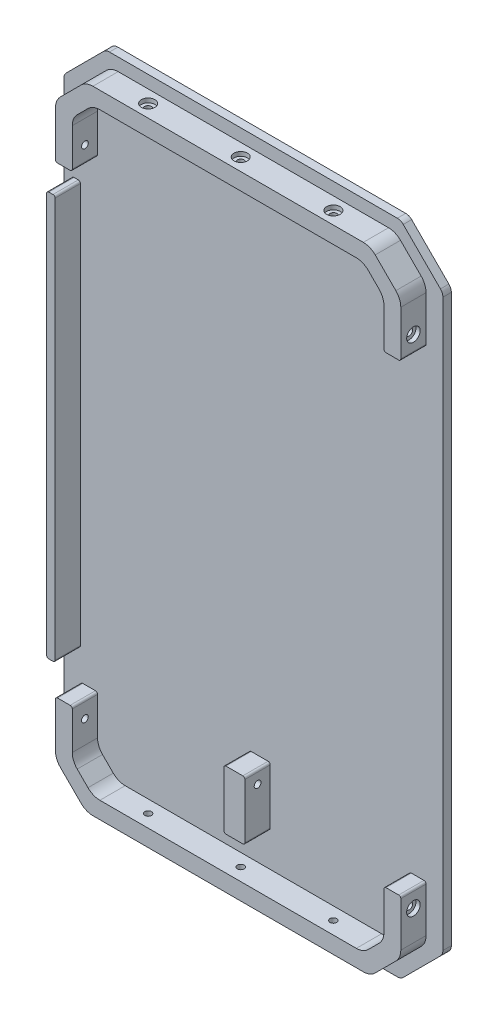
from build123d import *

# Parameters (mm, degrees)
SKETCH_1_W                = 90
SKETCH_1_H                = 156
EXTRUDE_1_DEPTH           = 2
CHAMFER_1_SIZE            = 10
FILLET_648_R              = 2
EXTRUDE_2_DEPTH           = 6
SHELL_3_T                 = -4
SHELL_3_THICKNESS_2_DEPTH = 2
SKETCH_17_W               = 18.399609766
SKETCH_17_H               = 163.649147631
SKETCH_17_W_2             = 16.459731854
SKETCH_17_H_2             = 168.058563627
CUT_EXTRUDE_14_DEPTH      = 6
SKETCH_8_W                = 109.527726605
SKETCH_8_H                = 110
CUT_EXTRUDE_4177_DEPTH    = 6
EXTRUDE_5_DEPTH           = 6
SKETCH_5_R                = 0.8
CUT_EXTRUDE_5486_DEPTH    = 200
FILLET_5638_R             = 4
SKETCH_4_R                = 0.8
CUT_EXTRUDE_6124_DEPTH    = 100
SKETCH_6_W                = 5
SKETCH_6_H                = 14
EXTRUDE_C_DEPTH           = 6
SKETCH_9_R                = 0.8
CUT_EXTRUDE_C_DEPTH       = 50
SKETCH_23_R               = 1.6
CUT_EXTRUDE_16_DEPTH      = 1
CUT_EXTRUDE_START         = -1
SKETCH_24_R               = 1.6
CUT_EXTRUDE_17_DEPTH      = 1
SKETCH_22_R               = 1.6
CUT_EXTRUDE_15_DEPTH      = 1
SKETCH_13_R               = 1.6
CUT_EXTRUDE_10_DEPTH      = 1
SKETCH_18_W               = 2
SKETCH_18_H               = 96
EXTRUDE_4_DEPTH           = 6
FILLET_1_R                = 4
FILLET_2_R                = 0.5
SKETCH_25_W               = 24.531639896
SKETCH_25_H               = 27.877987264
CUT_EXTRUDE_18_DEPTH      = 10


with BuildPart() as part:
    # 草图1 → 凸台-拉伸1 (new body)
    with BuildSketch(Plane.XY):
        with Locations((-45, 78)):
            Rectangle(SKETCH_1_W, SKETCH_1_H)
    extrude(amount=EXTRUDE_1_DEPTH)

    # 倒角1
    chamfer_1_edges = [part.edges().sort_by_distance(p)[0] for p in [
        (0, 0, 1),
        (-90, 0, 1),
        (-90, 156, 1),
        (0, 156, 1),
    ]]
    chamfer(chamfer_1_edges, length=CHAMFER_1_SIZE)

    # Fillet 648
    fillet_648_edges = [part.edges().sort_by_distance(p)[0] for p in [
        (0, 146, 1),
        (0, 10, 1),
        (-80, 0, 1),
        (-10, 0, 1),
        (-90, 146, 1),
        (-90, 10, 1),
        (-10, 156, 1),
        (-80, 156, 1),
    ]]
    fillet(fillet_648_edges, radius=FILLET_648_R)

    # 草图2 → 凸台-拉伸2 (add)
    with BuildSketch(Plane.XY.offset(2)):
        Polygon((-78.757359313, 153), (-11.242640687, 153), (-3, 144.757359313), (-3, 11.242640687), (-11.242640687, 3), (-78.757359313, 3), (-87, 11.242640687), (-87, 144.757359313), align=None)
    extrude(amount=EXTRUDE_2_DEPTH)

    # 抽壳3
    shell_3_openings = [part.faces().sort_by_distance(p)[0] for p in [
        (-45, 78, 8),
    ]]
    offset(amount=SHELL_3_T, openings=shell_3_openings, kind=Kind.INTERSECTION)

    # 抽壳3 thickness 2 face (on inner face of the shell) → 抽壳3 thickness 2 (cut)
    with BuildSketch(Plane(origin=(-45, 78, 4), x_dir=(-1, 0, 0), z_dir=(0, 0, -1))):
        Polygon((38, -65.100505063), (32.100505063, -71), (-32.100505063, -71), (-38, -65.100505063), (-38, 65.100505063), (-32.100505063, 71), (32.100505063, 71), (38, 65.100505063), align=None)
    extrude(amount=SHELL_3_THICKNESS_2_DEPTH, mode=Mode.SUBTRACT)

    # 草图17 → 切除-拉伸14 (cut)
    with BuildSketch(Plane.XY.offset(8)):
        with Locations((-95.199804883, 77.855305794)):
            Rectangle(SKETCH_17_W, SKETCH_17_H)
        with Locations((4.229865927, 75.650597796)):
            Rectangle(SKETCH_17_W_2, SKETCH_17_H_2)
    extrude(amount=-CUT_EXTRUDE_14_DEPTH, mode=Mode.SUBTRACT)

    # 草图8 → Cut-Extrude 4177 (cut)
    with BuildSketch(Plane.XY.offset(8)):
        with Locations((-46.223461864, 78)):
            Rectangle(SKETCH_8_W, SKETCH_8_H)
    extrude(amount=-CUT_EXTRUDE_4177_DEPTH, mode=Mode.SUBTRACT)

    # 草图21 → 凸台-拉伸5 (add)
    with BuildSketch(Plane.XY.offset(2)):
        Polygon((-82, 142.100505063), (-82, 144.100505063), (-83, 143.100505063), (-83, 133), (-82, 133), align=None)
        Polygon((-8, 142.100505063), (-8, 144.100505063), (-7, 143.100505063), (-7, 133), (-8, 133), align=None)
        Polygon((-82, 13.899494937), (-82, 11.899494937), (-83, 12.899494937), (-83, 23), (-82, 23), align=None)
        Polygon((-8, 13.899494937), (-8, 11.899494937), (-7, 12.899494937), (-7, 23), (-8, 23), align=None)
    extrude(amount=EXTRUDE_5_DEPTH)

    # 草图5 → Cut-Extrude 5486 (cut)
    with BuildSketch(Plane(origin=(0, 3, 0), x_dir=(-1, 0, 0), z_dir=(0, -1, 0))):
        with Locations(Location((67, -5, 0), (0, 0, 90))):
            Circle(SKETCH_5_R)
        with Locations(Location((23, -5, 0), (0, 0, 90))):
            Circle(SKETCH_5_R)
        with Locations(Location((45, -5, 0), (0, 0, 90))):
            Circle(SKETCH_5_R)
    extrude(amount=-CUT_EXTRUDE_5486_DEPTH, mode=Mode.SUBTRACT)

    # Fillet 5638
    fillet_5638_edges = [part.edges().sort_by_distance(p)[0] for p in [
        (-4, 145.757359313, 5),
        (-86, 10.242640687, 5),
        (-86, 145.757359313, 5),
        (-4, 10.242640687, 5),
        (-78.757359313, 153, 5),
        (-78.757359313, 3, 5),
        (-11.242640687, 3, 5),
        (-11.242640687, 153, 5),
    ]]
    fillet(fillet_5638_edges, radius=FILLET_5638_R)

    # 草图4 → Cut-Extrude 6124 (cut)
    with BuildSketch(Plane.ZY.offset(87)):
        with Locations(Location((5, 137, 0), (0, 0, 270))):
            Circle(SKETCH_4_R)
        with Locations(Location((5, 19, 0), (0, 0, 270))):
            Circle(SKETCH_4_R)
    extrude(amount=-CUT_EXTRUDE_6124_DEPTH, mode=Mode.SUBTRACT)

    # 草图6 → C板固定 (add)
    with BuildSketch(Plane.XY.offset(2)):
        with Locations((-48.5, 134)):
            Rectangle(SKETCH_6_W, SKETCH_6_H)
        with Locations((-43.5, 22)):
            Rectangle(SKETCH_6_W, SKETCH_6_H)
    extrude(amount=EXTRUDE_C_DEPTH)

    # 草图9 → C板螺纹 (cut)
    with BuildSketch(Plane(origin=(-41, 0, 0), x_dir=(0, 0, -1), z_dir=(1, 0, 0))):
        with Locations(Location((-5, 26, 0), (0, 0, 90))):
            Circle(SKETCH_9_R)
        with Locations((-5, 130)):
            Circle(SKETCH_9_R)
    extrude(amount=-CUT_EXTRUDE_C_DEPTH, mode=Mode.SUBTRACT)

    # 草图23 → 切除-拉伸16 (cut)
    with BuildSketch(Plane.ZY.offset(86)):
        with Locations(Location((5, 137, 0), (0, 0, 270))):
            Circle(SKETCH_23_R)
        with Locations(Location((5, 19, 0), (0, 0, 270))):
            Circle(SKETCH_23_R)
    extrude(amount=-CUT_EXTRUDE_16_DEPTH, mode=Mode.SUBTRACT)

    # 草图24 → 切除-拉伸17 (cut)
    with BuildSketch(Plane(origin=(-4, 0, 0), x_dir=(0, 0, -1), z_dir=(1, 0, 0)).offset(CUT_EXTRUDE_START)):
        with Locations(Location((-5, 19, 0), (0, 0, 270))):
            Circle(SKETCH_24_R)
        with Locations(Location((-5, 137, 0), (0, 0, 270))):
            Circle(SKETCH_24_R)
    extrude(amount=CUT_EXTRUDE_17_DEPTH, mode=Mode.SUBTRACT)

    # 草图22 → 切除-拉伸15 (cut)
    with BuildSketch(Plane(origin=(0, 3, 0), x_dir=(-1, 0, 0), z_dir=(0, -1, 0))):
        with Locations(Location((67, -5, 0), (0, 0, 90))):
            Circle(SKETCH_22_R)
        with Locations(Location((45, -5, 0), (0, 0, 90))):
            Circle(SKETCH_22_R)
        with Locations(Location((23, -5, 0), (0, 0, 90))):
            Circle(SKETCH_22_R)
    extrude(amount=-CUT_EXTRUDE_15_DEPTH, mode=Mode.SUBTRACT)

    # 草图13 → 切除-拉伸10 (cut)
    with BuildSketch(Plane(origin=(0, 153, 0), x_dir=(1, 0, 0), z_dir=(0, 1, 0)).offset(CUT_EXTRUDE_START)):
        with Locations(Location((-67, -5, 0), (0, 0, 90))):
            Circle(SKETCH_13_R)
        with Locations(Location((-45, -5, 0), (0, 0, 90))):
            Circle(SKETCH_13_R)
        with Locations(Location((-23, -5, 0), (0, 0, 90))):
            Circle(SKETCH_13_R)
    extrude(amount=CUT_EXTRUDE_10_DEPTH, mode=Mode.SUBTRACT)

    # 草图18 → 凸台-拉伸4 (add)
    with BuildSketch(Plane.XY.offset(2)):
        with Locations((-87.078063163, 78)):
            Rectangle(SKETCH_18_W, SKETCH_18_H)
    extrude(amount=EXTRUDE_4_DEPTH)

    # 圆角1
    fillet_1_edges = [part.edges().sort_by_distance(p)[0] for p in [
        (-77.100505063, 149, 5),
        (-77.100505063, 7, 5),
        (-12.899494937, 7, 5),
        (-12.899494937, 149, 5),
        (-82, 144.100505063, 5),
        (-8, 144.100505063, 5),
        (-82, 11.899494937, 5),
        (-8, 11.899494937, 5),
    ]]
    fillet(fillet_1_edges, radius=FILLET_1_R)

    # 圆角2
    fillet_2_edges = [part.edges().sort_by_distance(p)[0] for p in [
        (-86, 133, 5),
        (-86, 23, 5),
        (-4, 23, 5),
        (-4, 133, 5),
        (-82, 133, 5),
        (-8, 133, 5),
        (-82, 23, 5),
        (-8, 23, 5),
        (-51, 141, 5),
        (-51, 127, 5),
        (-46, 127, 5),
        (-46, 141, 5),
        (-41, 15, 5),
        (-41, 29, 5),
        (-46, 29, 5),
        (-46, 15, 5),
        (-88.078063163, 126, 5),
        (-88.078063163, 30, 5),
        (-86.078063163, 30, 5),
        (-86.078063163, 126, 5),
    ]]
    fillet(fillet_2_edges, radius=FILLET_2_R)

    # 草图25 → 切除-拉伸18 (cut)
    with BuildSketch(Plane.XY.offset(2)):
        with Locations((-48.129545647, 132.25729865)):
            Rectangle(SKETCH_25_W, SKETCH_25_H)
    extrude(amount=CUT_EXTRUDE_18_DEPTH, mode=Mode.SUBTRACT)


solid = part.part
